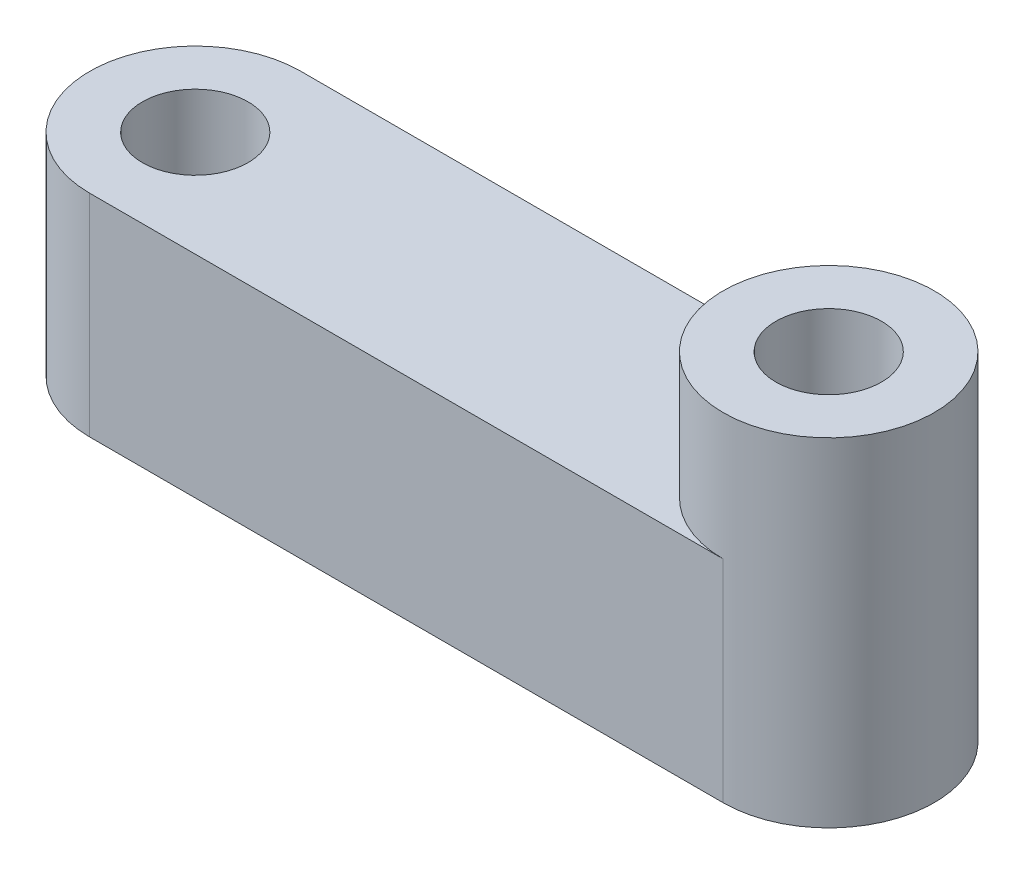
from build123d import *

# Parameters (mm, degrees)
BOSS_EXTRUDE1_DEPTH      = 4
BOSS_EXTRUDE1_DEPTH_BACK = 6
SKETCH1_R                = 2.5
BOSS_EXTRUDE3_DEPTH      = 11
BOSS_EXTRUDE3_DEPTH_BACK = 5
SKETCH3_R                = 5
SKETCH3_R_2              = 2.5


with BuildPart() as part:
    # Sketch1 → Boss-Extrude1 (new, two sides: drawn at the far end of the back side and taken through both)
    with BuildSketch(Plane(origin=(0, 0, 0), x_dir=(1, 0, 0), z_dir=(0, 1, 0)).offset(-BOSS_EXTRUDE1_DEPTH_BACK)):
        with BuildLine():
            Line((0, 5), (30, 5))
            ThreePointArc((30, 5), (35, 0), (30, -5))
            Line((30, -5), (0, -5))
            ThreePointArc((0, -5), (-5, 0), (0, 5))
        make_face()
        with Locations(Location((0, 0, 0), (0, 0, 270))):
            Circle(SKETCH1_R, mode=Mode.SUBTRACT)
        with Locations(Location((30, 0, 0), (0, 0, 270))):
            Circle(SKETCH1_R, mode=Mode.SUBTRACT)
    extrude(amount=BOSS_EXTRUDE1_DEPTH + BOSS_EXTRUDE1_DEPTH_BACK)

    # Sketch3 → Boss-Extrude3 (add, two sides: drawn at the far end of the back side and taken through both)
    with BuildSketch(Plane(origin=(0, -1, 0), x_dir=(1, 0, 0), z_dir=(0, 1, 0)).offset(-BOSS_EXTRUDE3_DEPTH_BACK)):
        with Locations(Location((30, 0, 0), (0, 0, 270))):
            Circle(SKETCH3_R)
        with Locations(Location((30, 0, 0), (0, 0, 270))):
            Circle(SKETCH3_R_2, mode=Mode.SUBTRACT)
    extrude(amount=BOSS_EXTRUDE3_DEPTH + BOSS_EXTRUDE3_DEPTH_BACK)


solid = part.part
